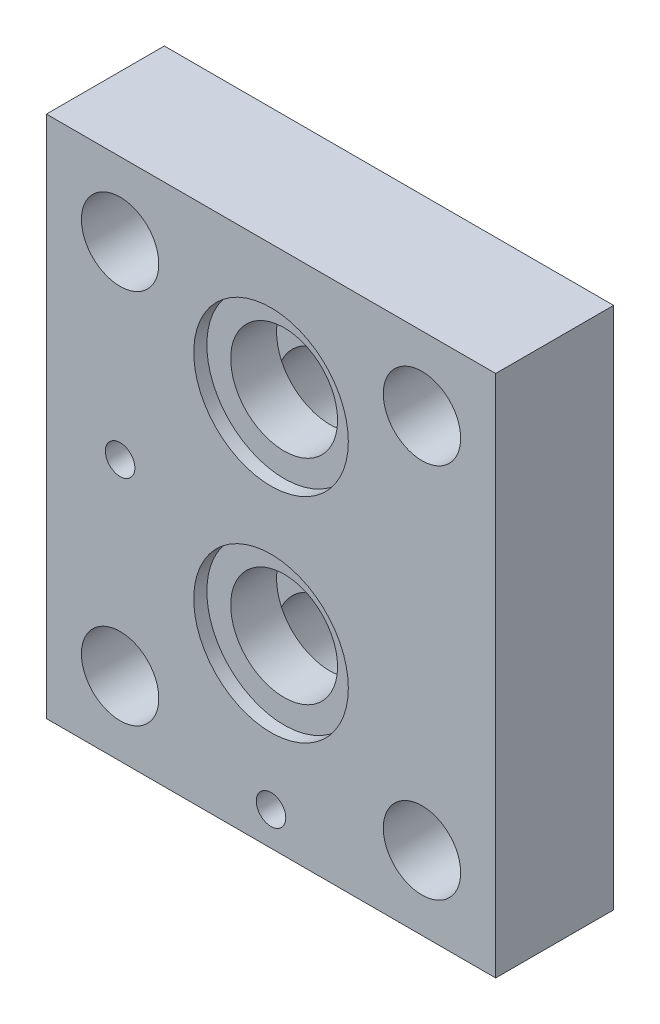
from build123d import *

# Parameters (mm, degrees)
SKETCH1_W                   = 112.776
SKETCH1_H                   = 96.774
BOSS_EXTRUDE1_DEPTH         = 12.7
F_5_8_CLEARANCE_HOLE1_D     = 16.66875
F_5_8_CLEARANCE_HOLE1_DEPTH = 25.4
F_5_8_CLEARANCE_HOLE1_TIP   = 5.007797722
F_5_8_CLEARANCE_HOLE2_D     = 16.66875
F_5_8_CLEARANCE_HOLE2_DEPTH = 25.4
F_5_8_CLEARANCE_HOLE2_TIP   = 5.007797722
CUT_EXTRUDE2_START          = -12.7
SKETCH6_R                   = 11.509375
CUT_EXTRUDE2_DEPTH          = 12.7
CUT_EXTRUDE4_START          = -12.7
SKETCH7_R                   = 11.509375
CUT_EXTRUDE4_DEPTH          = 12.7
CUT_EXTRUDE6_START          = 12.7
SKETCH8_R                   = 11.509375
CUT_EXTRUDE6_DEPTH          = 12.7
CUT_EXTRUDE8_START          = 12.7
SKETCH9_R                   = 11.509375
CUT_EXTRUDE8_DEPTH          = 12.7
CUT_EXTRUDE10_START         = 12.7
SKETCH10_R                  = 16.6497
CUT_EXTRUDE10_DEPTH         = 2.8194
CUT_EXTRUDE12_START         = 12.7
SKETCH11_R                  = 16.6497
CUT_EXTRUDE12_DEPTH         = 2.8194
CUT_EXTRUDE14_START         = -12.7
SKETCH12_R                  = 3.571875
CUT_EXTRUDE14_DEPTH         = 7.874
CUT_EXTRUDE16_START         = 12.7
SKETCH13_R                  = 3.175
CUT_EXTRUDE16_DEPTH         = 7.874


with BuildPart() as part:
    # Sketch1 → Boss-Extrude1 (new, symmetric)
    with BuildSketch(Plane(origin=(0, 0, 0), x_dir=(0, 1, 0), z_dir=(0, 0, 1))):
        Rectangle(SKETCH1_W, SKETCH1_H)
    extrude(amount=BOSS_EXTRUDE1_DEPTH, both=True)

    # 5/8 Clearance Hole1
    with Locations(Plane(origin=(0, 0, -12.7), x_dir=(-1, 0, 0), z_dir=(0, 0, -1))):
        with Locations((-32.512, -40.513)):
            Hole(F_5_8_CLEARANCE_HOLE1_D / 2, depth=F_5_8_CLEARANCE_HOLE1_DEPTH)
            with Locations((0, 0, -(F_5_8_CLEARANCE_HOLE1_DEPTH + F_5_8_CLEARANCE_HOLE1_TIP / 2))):  # 118° drill point
                Cone(0, F_5_8_CLEARANCE_HOLE1_D / 2, F_5_8_CLEARANCE_HOLE1_TIP, mode=Mode.SUBTRACT)

    # 5/8 Clearance Hole2
    with Locations(Plane(origin=(0, 0, -12.7), x_dir=(-1, 0, 0), z_dir=(0, 0, -1))):
        with Locations((-32.512, 40.513), (32.512, -40.513), (32.512, 40.513)):
            Hole(F_5_8_CLEARANCE_HOLE2_D / 2, depth=F_5_8_CLEARANCE_HOLE2_DEPTH)
            with Locations((0, 0, -(F_5_8_CLEARANCE_HOLE2_DEPTH + F_5_8_CLEARANCE_HOLE2_TIP / 2))):  # 118° drill point
                Cone(0, F_5_8_CLEARANCE_HOLE2_D / 2, F_5_8_CLEARANCE_HOLE2_TIP, mode=Mode.SUBTRACT)

    # Sketch6 → Cut-Extrude2 (cut)
    with BuildSketch(Plane(origin=(0, 0, 0), x_dir=(0, 1, 0), z_dir=(0, 0, 1)).offset(CUT_EXTRUDE2_START)):
        with Locations(Location((-27.813, 0, 0), (0, 0, 270))):
            Circle(SKETCH6_R)
    extrude(amount=CUT_EXTRUDE2_DEPTH, mode=Mode.SUBTRACT)

    # Sketch7 → Cut-Extrude4 (cut)
    with BuildSketch(Plane(origin=(0, 0, 0), x_dir=(0, 1, 0), z_dir=(0, 0, 1)).offset(CUT_EXTRUDE4_START)):
        with Locations(Location((18.161, 0, 0), (0, 0, 270))):
            Circle(SKETCH7_R)
    extrude(amount=CUT_EXTRUDE4_DEPTH, mode=Mode.SUBTRACT)

    # Sketch8 → Cut-Extrude6 (cut)
    with BuildSketch(Plane(origin=(0, 0, 0), x_dir=(0, 1, 0), z_dir=(0, 0, 1)).offset(CUT_EXTRUDE6_START)):
        with Locations(Location((-18.161, 0, 0), (0, 0, 270))):
            Circle(SKETCH8_R)
    extrude(amount=-CUT_EXTRUDE6_DEPTH, mode=Mode.SUBTRACT)

    # Sketch9 → Cut-Extrude8 (cut)
    with BuildSketch(Plane(origin=(0, 0, 0), x_dir=(0, 1, 0), z_dir=(0, 0, 1)).offset(CUT_EXTRUDE8_START)):
        with Locations(Location((27.813, 0, 0), (0, 0, 270))):
            Circle(SKETCH9_R)
    extrude(amount=-CUT_EXTRUDE8_DEPTH, mode=Mode.SUBTRACT)

    # Sketch10 → Cut-Extrude10 (cut)
    with BuildSketch(Plane(origin=(0, 0, 0), x_dir=(0, 1, 0), z_dir=(0, 0, 1)).offset(CUT_EXTRUDE10_START)):
        with Locations(Location((-18.161, 0, 0), (0, 0, 270))):
            Circle(SKETCH10_R)
    extrude(amount=-CUT_EXTRUDE10_DEPTH, mode=Mode.SUBTRACT)

    # Sketch11 → Cut-Extrude12 (cut)
    with BuildSketch(Plane(origin=(0, 0, 0), x_dir=(0, 1, 0), z_dir=(0, 0, 1)).offset(CUT_EXTRUDE12_START)):
        with Locations(Location((27.813, 0, 0), (0, 0, 270))):
            Circle(SKETCH11_R)
    extrude(amount=-CUT_EXTRUDE12_DEPTH, mode=Mode.SUBTRACT)

    # Sketch12 → Cut-Extrude14 (cut)
    with BuildSketch(Plane(origin=(0, 0, 0), x_dir=(0, 1, 0), z_dir=(0, 0, 1)).offset(CUT_EXTRUDE14_START)):
        with Locations(Location((49.149, 0, 0), (0, 0, 270))):
            Circle(SKETCH12_R)
        with Locations(Location((0.127, -32.512, 0), (0, 0, 270))):
            Circle(SKETCH12_R)
    extrude(amount=CUT_EXTRUDE14_DEPTH, mode=Mode.SUBTRACT)

    # Sketch13 → Cut-Extrude16 (cut)
    with BuildSketch(Plane(origin=(0, 0, 0), x_dir=(0, 1, 0), z_dir=(0, 0, 1)).offset(CUT_EXTRUDE16_START)):
        with Locations(Location((-49.149, 0, 0), (0, 0, 270))):
            Circle(SKETCH13_R)
        with Locations(Location((-0.127, 32.512, 0), (0, 0, 270))):
            Circle(SKETCH13_R)
    extrude(amount=-CUT_EXTRUDE16_DEPTH, mode=Mode.SUBTRACT)


solid = part.part
